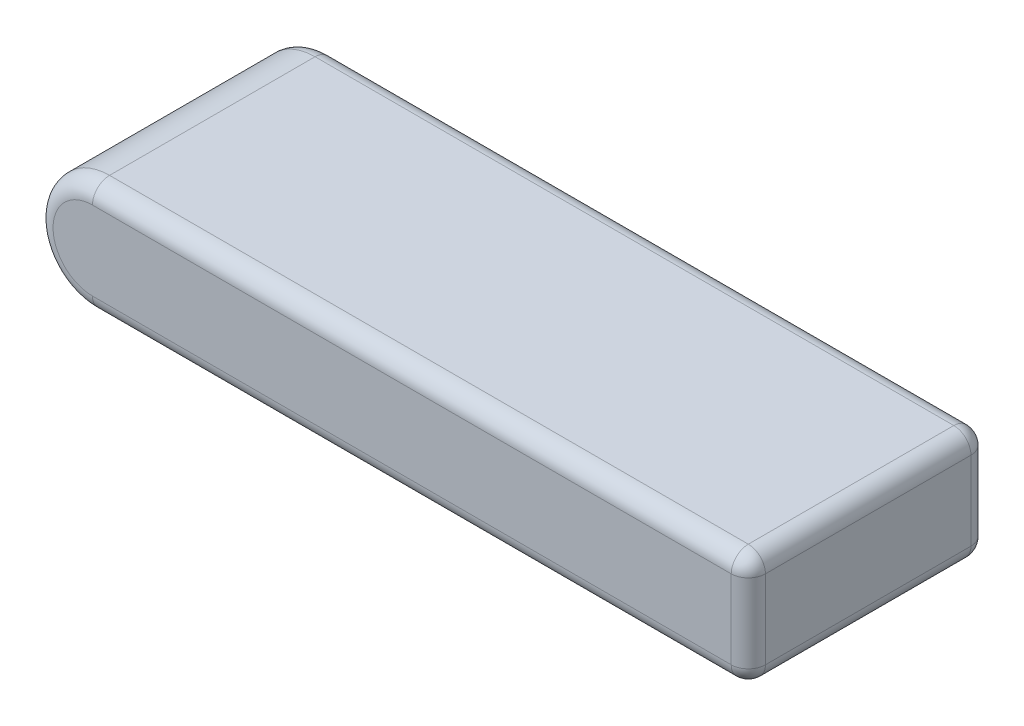
from build123d import *

# Parameters (mm, degrees)
SKETCH1_W           = 104
SKETCH1_H           = 35
BOSS_EXTRUDE1_DEPTH = 16.5
FILLET2_RADIUS      = 8.25
FILLET2_LENGTH      = 35
FILLET3_R           = 2.5


with BuildPart() as part:
    # Sketch1 → Boss-Extrude1 (new body)
    with BuildSketch(Plane(origin=(0, 0, 0), x_dir=(1, 0, 0), z_dir=(0, 1, 0))):
        Rectangle(SKETCH1_W, SKETCH1_H)
    extrude(amount=BOSS_EXTRUDE1_DEPTH)

    # Fillet2: full round fillet: the end face becomes a half cylinder, R = half its width
    fillet2_face = Plane((-52, 8.25, 0), x_dir=(0, 0, -1), z_dir=(-1, 0, 0))  # on the end face: x along it, z out of the body
    fillet2_slab = fillet2_face.offset(-FILLET2_RADIUS / 2) * Box(FILLET2_LENGTH, 2 * FILLET2_RADIUS, FILLET2_RADIUS, mode=Mode.PRIVATE)  # the body's end, R deep
    fillet2_round = Plane((-43.75, 8.25, 0), x_dir=(-1, 0, 0), z_dir=(0, 0, -1)) * Cylinder(FILLET2_RADIUS, FILLET2_LENGTH, mode=Mode.PRIVATE)  # its axis R under the face
    add(fillet2_slab - fillet2_round, mode=Mode.SUBTRACT)

    # Fillet3
    fillet3_edges = [part.edges().sort_by_distance(p)[0] for p in [
        (52, 16.5, 0),
        (4.125, 16.5, 17.5),
        (4.125, 0, 17.5),
        (4.125, 16.5, -17.5),
        (-52, 8.25, -17.5),
        (-52, 8.25, 17.5),
        (4.125, 0, -17.5),
        (52, 0, 0),
        (52, 8.25, -17.5),
        (52, 8.25, 17.5),
    ]]
    fillet(fillet3_edges, radius=FILLET3_R)


solid = part.part
